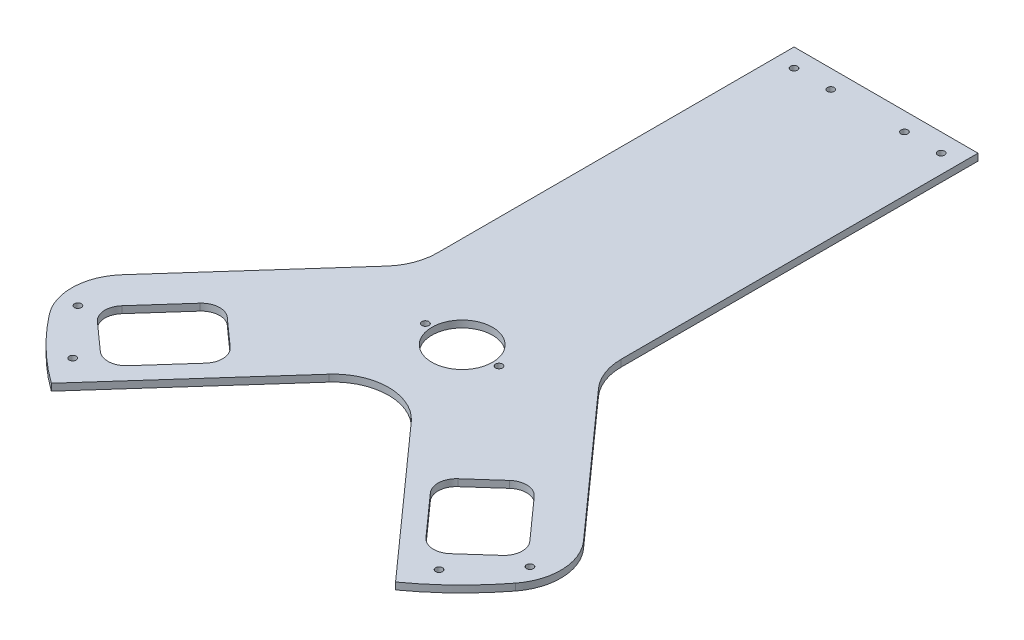
from build123d import *

# Parameters (mm, degrees)
SKETCH1_R           = 2.38125
SKETCH1_R_2         = 20.955
BOSS_EXTRUDE1_DEPTH = 4.7625
SKETCH2_R           = 2.38125
CUT_EXTRUDE1_DEPTH  = 343.797654481
FILLET1_R           = 38.1
SKETCH4_R           = 2.38125
CUT_EXTRUDE3_DEPTH  = 343.797654481
FILLET2_R           = 38.1
CUT_EXTRUDE4_DEPTH  = 338.871506933
FILLET3_R           = 12.7


with BuildPart() as part:
    # Sketch1 → Boss-Extrude1 (new body)
    with BuildSketch(Plane(origin=(0, 0, 0), x_dir=(1, 0, 0), z_dir=(0, 1, 0))):
        with BuildLine():
            Line((63.5, 31.75), (63.5, 292.608))
            Line((63.5, 292.608), (-63.5, 292.608))
            Line((-63.5, 292.608), (-63.5, 31.75))
            Line((-63.5, 31.75), (-178.516410583, -97.067662754))
            ThreePointArc((-178.516410583, -97.067662754), (-152.483723292, -134.309173667), (-118.826410583, -164.834838999))
            Line((-118.826410583, -164.834838999), (0, -31.75))
            Line((0, -31.75), (118.826410583, -164.834838999))
            ThreePointArc((118.826410583, -164.834838999), (152.483723292, -134.309173667), (178.516410583, -97.067662754))
            Line((178.516410583, -97.067662754), (63.5, 31.75))
        make_face()
        with Locations(Location((-25.4, 0, 0), (0, 0, 90))):
            Circle(SKETCH1_R, mode=Mode.SUBTRACT)
        with Locations(Location((0, 0, 0), (0, 0, 90))):
            Circle(SKETCH1_R_2, mode=Mode.SUBTRACT)
        with Locations(Location((25.4, 0, 0), (0, 0, 90))):
            Circle(SKETCH1_R, mode=Mode.SUBTRACT)
    extrude(amount=BOSS_EXTRUDE1_DEPTH)

    # Sketch2 → Cut-Extrude1 (cut, through all)
    with BuildSketch(Plane(origin=(0, 4.7625, 0), x_dir=(1, 0, 0), z_dir=(0, 1, 0))):
        with Locations(Location((25.4, 279.908, 0), (0, 0, 270))):
            Circle(SKETCH2_R)
        with Locations(Location((50.8, 279.908, 0), (0, 0, 270))):
            Circle(SKETCH2_R)
        with Locations(Location((-50.8, 279.908, 0), (0, 0, 270))):
            Circle(SKETCH2_R)
        with Locations(Location((-25.4, 279.908, 0), (0, 0, 270))):
            Circle(SKETCH2_R)
    extrude(amount=-CUT_EXTRUDE1_DEPTH, mode=Mode.SUBTRACT)

    # Fillet1
    fillet1_edges = [part.edges().sort_by_distance(p)[0] for p in [
        (63.5, 2.38125, -31.75),
        (0, 2.38125, 31.75),
        (-63.5, 2.38125, -31.75),
    ]]
    fillet(fillet1_edges, radius=FILLET1_R)

    # Sketch4 → Cut-Extrude3 (cut, through all)
    with BuildSketch(Plane(origin=(0, 4.7625, 0), x_dir=(1, 0, 0), z_dir=(0, 1, 0))):
        with Locations(Location((-156.048464437, -109.266311125, 0), (0, 0, 270))):
            Circle(SKETCH4_R)
        with Locations(Location((-126.479111192, -142.454499515, 0), (0, 0, 270))):
            Circle(SKETCH4_R)
        with Locations(Location((126.479111192, -142.454499515, 0), (0, 0, 270))):
            Circle(SKETCH4_R)
        with Locations(Location((156.048464437, -109.266311125, 0), (0, 0, 270))):
            Circle(SKETCH4_R)
    extrude(amount=-CUT_EXTRUDE3_DEPTH, mode=Mode.SUBTRACT)

    # Fillet2
    fillet2_edges = [part.edges().sort_by_distance(p)[0] for p in [
        (178.516410583, 2.38125, 97.067662754),
        (-178.516410583, 2.38125, 97.067662754),
    ]]
    fillet(fillet2_edges, radius=FILLET2_R)

    # Sketch5 → Cut-Extrude4 (cut, through all)
    with BuildSketch(Plane(origin=(0, 4.7625, 0), x_dir=(1, 0, 0), z_dir=(0, 1, 0))):
        Polygon((-149.276482194, -103.59593683), (-111.382942554, -137.429642709), (-69.090810204, -90.062718159), (-106.984349844, -56.22901228), align=None)
        Polygon((106.984349844, -56.22901228), (69.090810204, -90.062718159), (111.382942554, -137.429642709), (149.276482194, -103.59593683), align=None)
    extrude(amount=-CUT_EXTRUDE4_DEPTH, mode=Mode.SUBTRACT)

    # Fillet3
    fillet3_edges = [part.edges().sort_by_distance(p)[0] for p in [
        (-149.276482194, 2.38125, 103.59593683),
        (-106.984349844, 2.38125, 56.22901228),
        (-69.090810204, 2.38125, 90.062718159),
        (-111.382942554, 2.38125, 137.429642709),
        (106.984349844, 2.38125, 56.22901228),
        (149.276482194, 2.38125, 103.59593683),
        (111.382942554, 2.38125, 137.429642709),
        (69.090810204, 2.38125, 90.062718159),
    ]]
    fillet(fillet3_edges, radius=FILLET3_R)


solid = part.part
